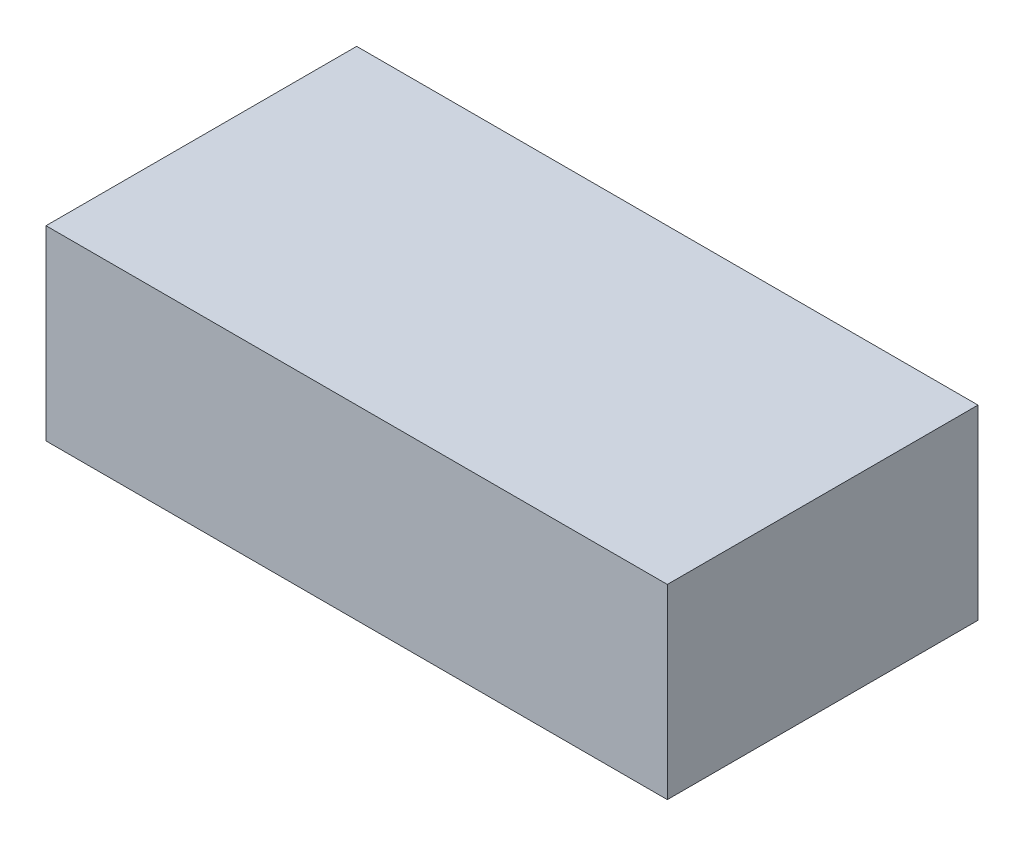
from build123d import *

# Parameters (mm, degrees)
SKETCH1_W           = 20
SKETCH1_H           = 6
BOSS_EXTRUDE1_DEPTH = 10


with BuildPart() as part:
    # Sketch1 → Boss-Extrude1 (new body)
    with BuildSketch(Plane.XY):
        with Locations((-105.5, 0)):
            Rectangle(SKETCH1_W, SKETCH1_H)
    extrude(amount=BOSS_EXTRUDE1_DEPTH)


solid = part.part
